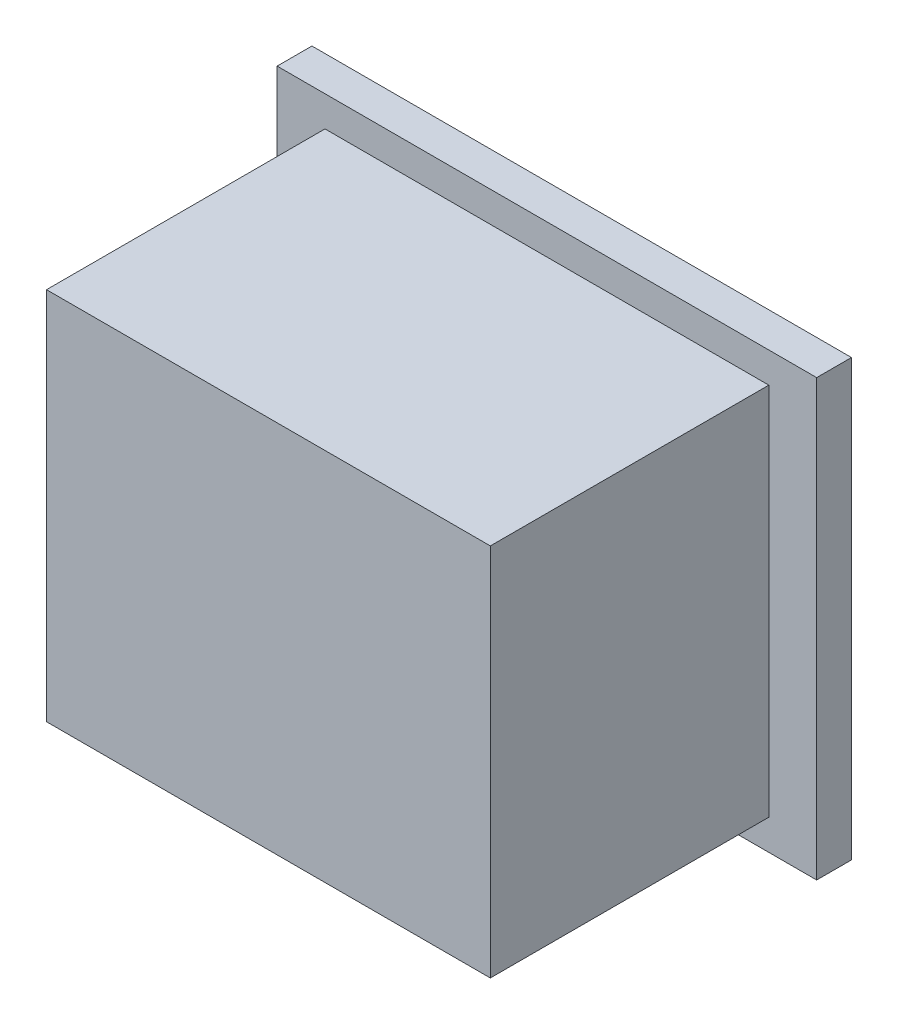
from build123d import *

# Parameters (mm, degrees)
SKETCH1_W           = 25.5
SKETCH1_H           = 21.5
BOSS_EXTRUDE1_DEPTH = 16
SKETCH2_W           = 31
SKETCH2_H           = 25
BOSS_EXTRUDE2_DEPTH = 2


with BuildPart() as part:
    # Sketch1 → Boss-Extrude1 (new body)
    with BuildSketch(Plane.XY):
        Rectangle(SKETCH1_W, SKETCH1_H)
    extrude(amount=BOSS_EXTRUDE1_DEPTH)

    # Sketch2 → Boss-Extrude2 (add)
    with BuildSketch(Plane(origin=(0, 0, 0), x_dir=(-1, 0, 0), z_dir=(0, 0, -1))):
        Rectangle(SKETCH2_W, SKETCH2_H)
    extrude(amount=BOSS_EXTRUDE2_DEPTH)


solid = part.part
